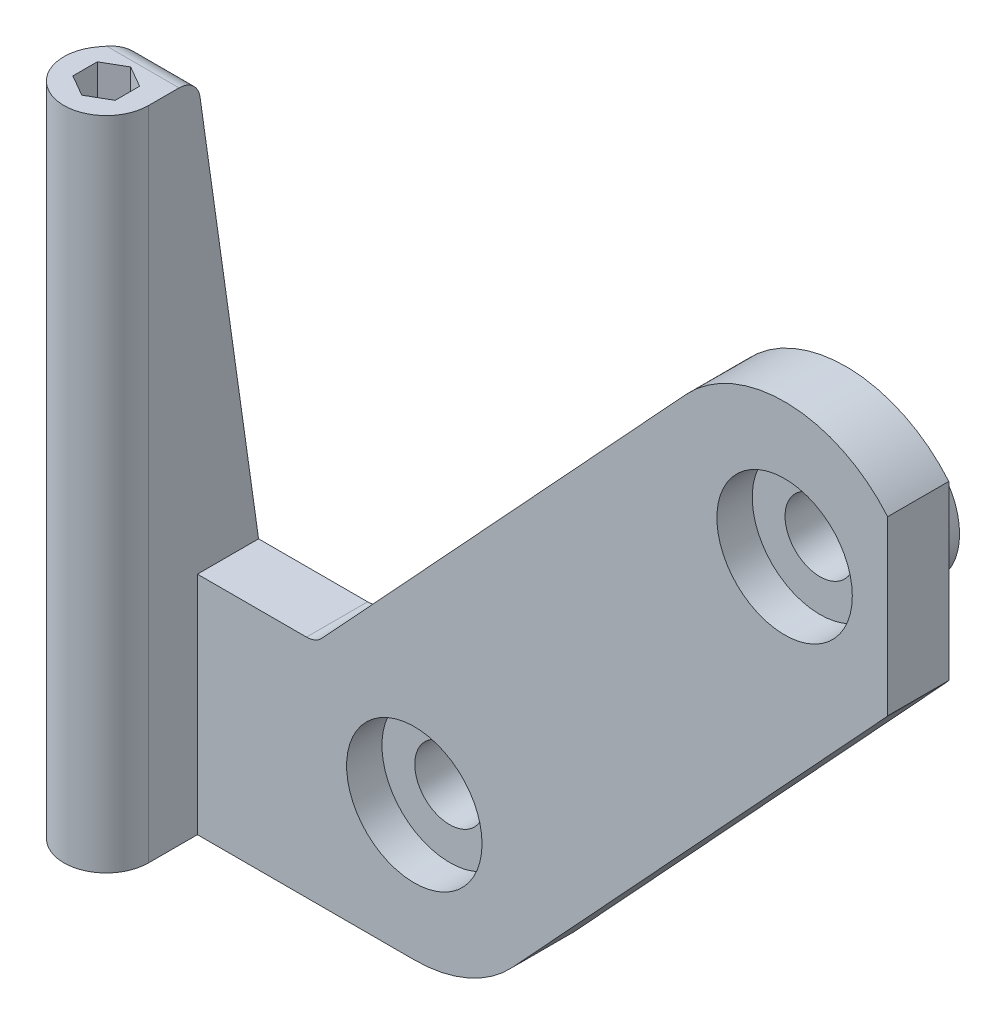
from build123d import *

# Parameters (mm, degrees)
BOSS_EXTRUDE1_DEPTH = 1.445
SKETCH2_R           = 3.2
CUT_EXTRUDE1_DEPTH  = 1.67
SKETCH3_R           = 3.2
BOSS_EXTRUDE2_DEPTH = 3.4
CUT_EXTRUDE3_DEPTH  = 36.101138158
SKETCH6_R           = 1.65
CUT_EXTRUDE4_DEPTH  = 34.904858059
BOSS_EXTRUDE3_DEPTH = 2.89
BOSS_EXTRUDE4_DEPTH = 31
BOSS_EXTRUDE5_DEPTH = 2.75
FILLET2_R           = 1


with BuildPart() as part:
    # Sketch1 → Boss-Extrude1 (new, symmetric)
    with BuildSketch(Plane.XY):
        with BuildLine():
            Line((4.65938028, -4.314241), (22.15938028, 14.585759))
            ThreePointArc((22.15938028, 14.585759), (21.814241, 23.55938028), (12.84061972, 23.214241))
            Line((12.84061972, 23.214241), (-4.65938028, 4.314241))
            ThreePointArc((-4.65938028, 4.314241), (-4.314241, -4.65938028), (4.65938028, -4.314241))
        make_face()
    extrude(amount=BOSS_EXTRUDE1_DEPTH, both=True)

    # Sketch2 → Cut-Extrude1 (cut)
    with BuildSketch(Plane.XY.offset(1.445)):
        Circle(SKETCH2_R)
        with Locations((17.5, 18.9)):
            Circle(SKETCH2_R)
    extrude(amount=-CUT_EXTRUDE1_DEPTH, mode=Mode.SUBTRACT)

    # Sketch3 → Boss-Extrude2 (add)
    with BuildSketch(Plane.XY.offset(-0.225)):
        Circle(SKETCH3_R)
        with Locations((17.5, 18.9)):
            Circle(SKETCH3_R)
    extrude(amount=-BOSS_EXTRUDE2_DEPTH)

    # Sketch5 → Cut-Extrude3 (cut, through all)
    with BuildSketch(Plane.XY.offset(1.445)):
        with BuildLine():
            Line((22.37, 14.825003067), (22.37, 22.974996933))
            ThreePointArc((22.37, 22.974996933), (23.85, 18.9), (22.37, 14.825003067))
        make_face()
    extrude(amount=-CUT_EXTRUDE3_DEPTH, mode=Mode.SUBTRACT)

    # Sketch6 → Cut-Extrude4 (cut, through all)
    with BuildSketch(Plane.XY.offset(-0.225)):
        Circle(SKETCH6_R)
        with Locations((17.5, 18.9)):
            Circle(SKETCH6_R)
    extrude(amount=-CUT_EXTRUDE4_DEPTH, mode=Mode.SUBTRACT)

    # Sketch7 → Boss-Extrude3 (add)
    with BuildSketch(Plane.XY.offset(1.445)):
        with BuildLine():
            Line((-4.65938028, 4.314241), (-13, 4.314241))
            Line((-13, 4.314241), (-13, -6.35))
            Line((-13, -6.35), (0, -6.35))
            ThreePointArc((0, -6.35), (-5.818845691, -2.542348289), (-4.65938028, 4.314241))
        make_face()
    extrude(amount=-BOSS_EXTRUDE3_DEPTH)

    # Sketch8 → Boss-Extrude4 (add)
    with BuildSketch(Plane.XZ.offset(6.35)):
        with BuildLine():
            Line((-13.837814719, 2.538922528), (-13, 1.445))
            Line((-13, 1.445), (-10.25, 1.445))
            Line((-10.25, 1.445), (-10.25, 3.755))
            ThreePointArc((-10.25, 3.755), (-12.892016574, 5.649152771), (-13.837814719, 2.538922528))
        make_face()
        Polygon((-11.25, 3.177649731), (-12.25, 2.600299462), (-13.25, 3.177649731), (-13.25, 4.332350269), (-12.25, 4.909700538), (-11.25, 4.332350269), align=None, mode=Mode.SUBTRACT)
    extrude(amount=-BOSS_EXTRUDE4_DEPTH)

    # Sketch10 → Boss-Extrude5 (add)
    with BuildSketch(Plane.ZY.offset(13)):
        Polygon((-1.445, 4.314241), (1.445, 24.65), (1.445, 4.314241), align=None)
    extrude(amount=-BOSS_EXTRUDE5_DEPTH)

    # Fillet2
    fillet2_edges = [part.edges().sort_by_distance(p)[0] for p in [
        (-4.65938028, 4.314241, 0),
        (-11.625, 24.65, 1.445),
    ]]
    fillet(fillet2_edges, radius=FILLET2_R)


solid = part.part
